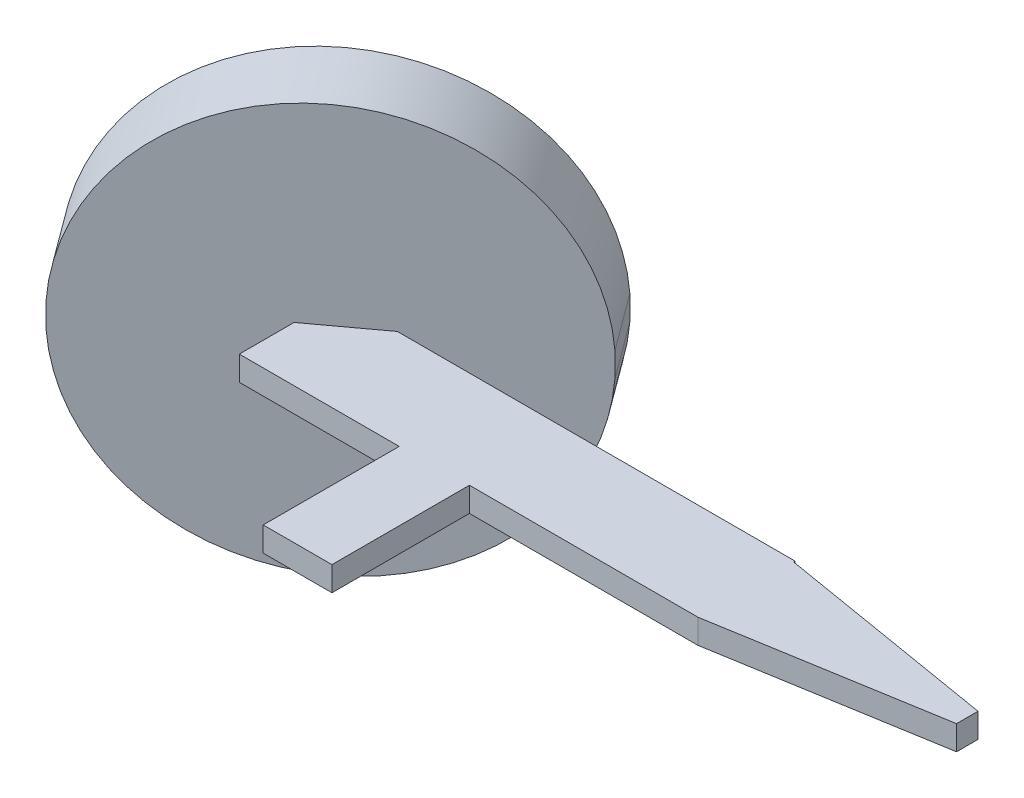
from build123d import *

# Parameters (mm, degrees)
BOSS_EXTRUDE2_DEPTH = 4
SKETCH2_W           = 66.649543755
SKETCH2_H           = 4
BOSS_EXTRUDE3_DEPTH = 11.554247081
CUT_EXTRUDE1_DEPTH  = 15


with BuildPart() as part:
    # Sketch1 → Boss-Extrude2 (new body)
    with BuildSketch(Plane(origin=(0, 0, 0), x_dir=(1, 0, 0), z_dir=(0, 1, 0))):
        Polygon((-62.077281721, 8.137219556), (-55.223313467, -1.164594503), (-31.821995465, 16.078481919), (-31.821995465, 7.098752834), (-5.630045351, 7.098752834), (-5.630045351, -15.176643991), (5.630045351, -15.176643991), (5.630045351, 7.098752834), (5.630045351, 7.343537415), (43.082086168, 7.343537415), (89.835941043, 7.343537415), (89.835941043, 23.009750567), (43.082086168, 23.009750567), (43.082086168, 23.254535147), (-22.083066084, 23.254535147), (-1.566709209, 38.371850739), (-8.420677463, 47.673664798), align=None)
    extrude(amount=-BOSS_EXTRUDE2_DEPTH)

    # Sketch2 → Boss-Extrude3 (add)
    with BuildSketch(Plane(origin=(-25.730067539, 0, -34.919377374), x_dir=(-0.8050558373533647, 0, 0.5931990380498546), z_dir=(-0.5931990380498546, 0, -0.8050558373533647))):
        with BuildLine():
            Line((-21.500856552, 0), (45.148687203, 0))
            ThreePointArc((45.148687203, 0), (11.823915325, 31.384733348), (-21.500856552, 0))
        make_face()
        with Locations((11.823915325, -2)):
            Rectangle(SKETCH2_W, SKETCH2_H)
        with BuildLine():
            ThreePointArc((-21.500856552, -4), (11.823915325, -35.384733348), (45.148687203, -4))
            Line((45.148687203, -4), (-21.500856552, -4))
        make_face()
    extrude(amount=-BOSS_EXTRUDE3_DEPTH)

    # Sketch3 → Cut-Extrude1 (cut)
    with BuildSketch(Plane.XZ.offset(4)):
        Polygon((79.345991619, -13.419165553), (79.345991619, -16.934122428), (43.082086168, -23.009750567), (79.345991619, -23.009750567), (89.835941043, -23.009750567), (89.835941043, -7.343537415), (79.345991619, -7.343537415), (43.082086168, -7.343537415), align=None)
    extrude(amount=-CUT_EXTRUDE1_DEPTH, mode=Mode.SUBTRACT)


solid = part.part
